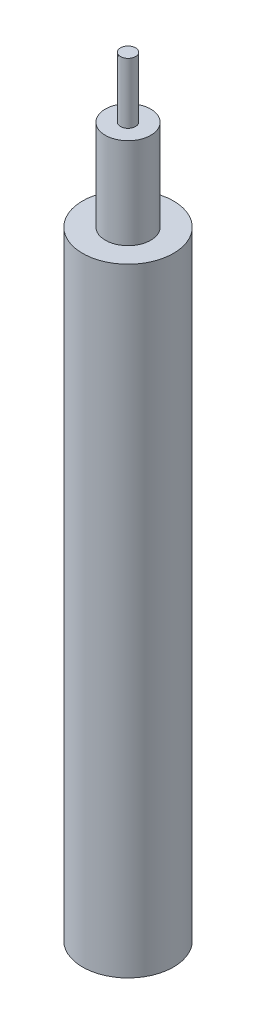
from build123d import *

# Parameters (mm, degrees)
SKETCH1_R           = 2.38125
BOSS_EXTRUDE1_DEPTH = 9.525
SKETCH2_R           = 4.7625
BOSS_EXTRUDE2_DEPTH = 64.77
SKETCH3_R           = 0.79375
BOSS_EXTRUDE3_DEPTH = 6.35


with BuildPart() as part:
    # Sketch1 → Boss-Extrude1 (new body)
    with BuildSketch(Plane(origin=(0, 0, 0), x_dir=(1, 0, 0), z_dir=(0, 1, 0))):
        with Locations(Location((0, 0, 0), (0, 0, 270))):
            Circle(SKETCH1_R)
    extrude(amount=-BOSS_EXTRUDE1_DEPTH)

    # Sketch2 → Boss-Extrude2 (add)
    with BuildSketch(Plane(origin=(0, -9.525, 0), x_dir=(-1, 0, 0), z_dir=(0, -1, 0))):
        with Locations(Location((0, 0, 0), (0, 0, 90))):
            Circle(SKETCH2_R)
    extrude(amount=BOSS_EXTRUDE2_DEPTH)

    # Sketch3 → Boss-Extrude3 (add)
    with BuildSketch(Plane(origin=(0, 0, 0), x_dir=(1, 0, 0), z_dir=(0, 1, 0))):
        with Locations(Location((0, 0, 0), (0, 0, 270))):
            Circle(SKETCH3_R)
    extrude(amount=BOSS_EXTRUDE3_DEPTH)


solid = part.part
